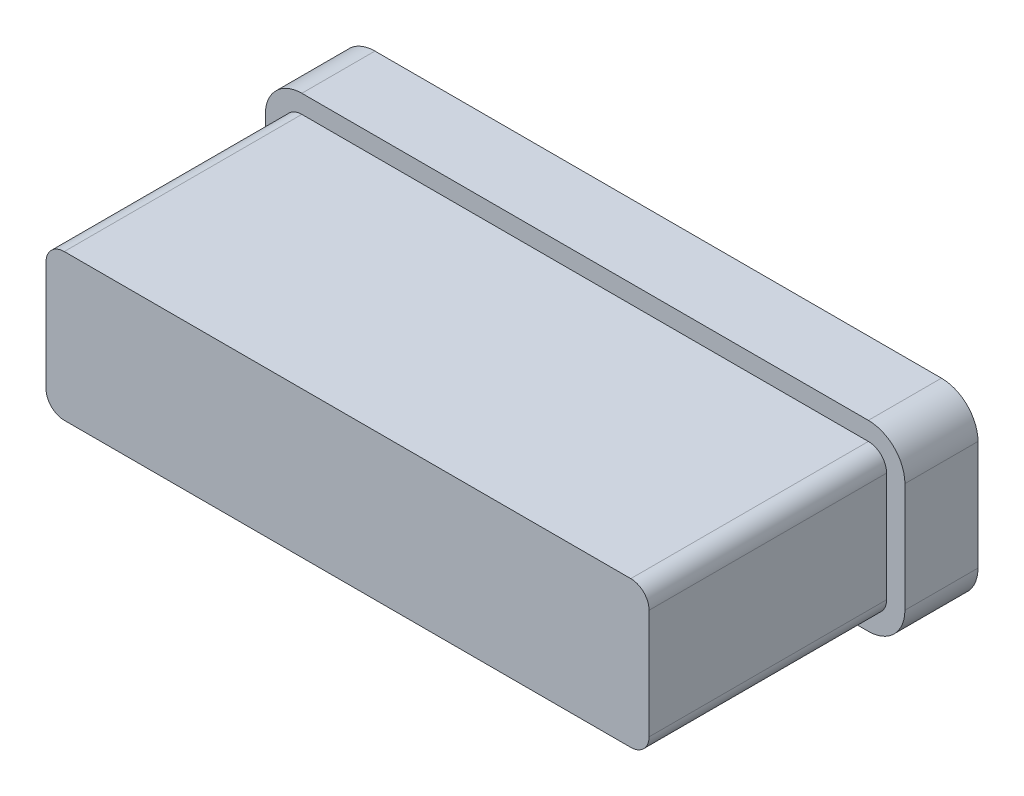
from build123d import *

# Parameters (mm, degrees)
SKETCH2_W           = 35
SKETCH2_H           = 10
BOSS_EXTRUDE1_DEPTH = 4
FILLET1_R           = 2
BOSS_EXTRUDE2_DEPTH = 13


with BuildPart() as part:
    # Sketch2 → Boss-Extrude1 (new body)
    with BuildSketch(Plane.XY):
        Rectangle(SKETCH2_W, SKETCH2_H)
    extrude(amount=BOSS_EXTRUDE1_DEPTH)

    # Fillet1
    fillet1_edges = [part.edges().sort_by_distance(p)[0] for p in [
        (17.5, -5, 2),
        (-17.5, -5, 2),
        (-17.5, 5, 2),
        (17.5, 5, 2),
    ]]
    fillet(fillet1_edges, radius=FILLET1_R)

    # Sketch3 → Boss-Extrude2 (add)
    with BuildSketch(Plane.XY.offset(4)):
        with BuildLine():
            Line((-16.5, 3), (-16.5, -3))
            ThreePointArc((-16.5, -3), (-16.207106781, -3.707106781), (-15.5, -4))
            Line((-15.5, -4), (15.5, -4))
            ThreePointArc((15.5, -4), (16.207106781, -3.707106781), (16.5, -3))
            Line((16.5, -3), (16.5, 3))
            ThreePointArc((16.5, 3), (16.207106781, 3.707106781), (15.5, 4))
            Line((15.5, 4), (-15.5, 4))
            ThreePointArc((-15.5, 4), (-16.207106781, 3.707106781), (-16.5, 3))
        make_face()
    extrude(amount=BOSS_EXTRUDE2_DEPTH)


solid = part.part
